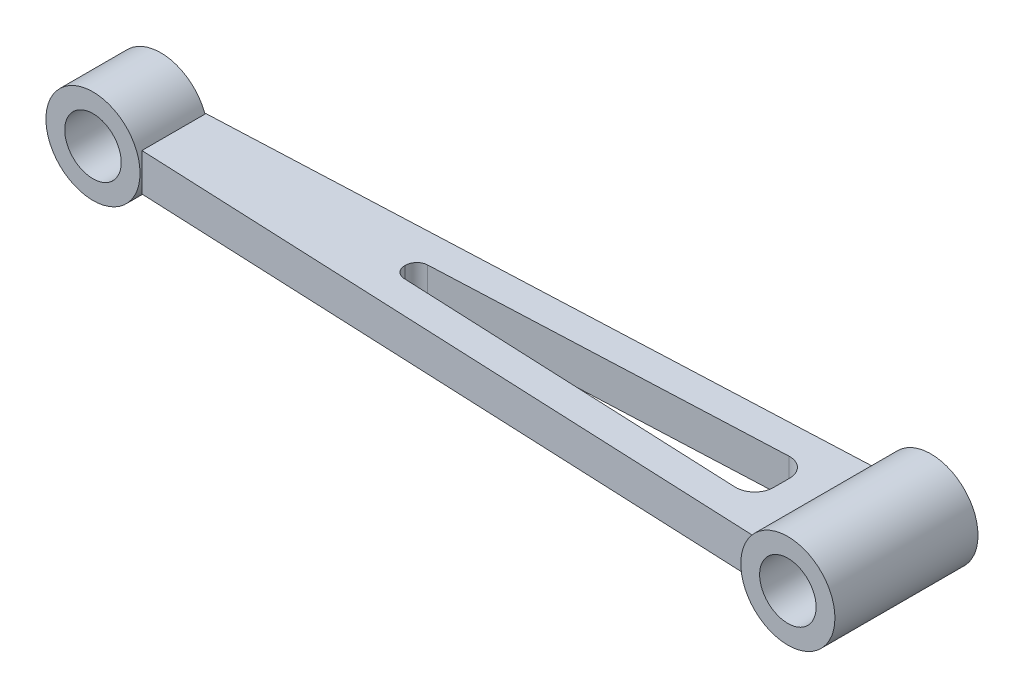
from build123d import *

# Parameters (mm, degrees)
BOSS_EXTRUDE1_DEPTH = 10
SKETCH3_R           = 12.5
SKETCH3_R_2         = 7.5
BOSS_EXTRUDE2_DEPTH = 9
SKETCH4_R           = 12.5
SKETCH4_R_2         = 7.5
BOSS_EXTRUDE3_DEPTH = 19


with BuildPart() as part:
    # Sketch2 → Boss-Extrude1 (new body)
    with BuildSketch(Plane(origin=(0, 0, 0), x_dir=(1, 0, 0), z_dir=(0, 1, 0))):
        Polygon((0, 8.5), (169.56, 15.90314948), (169.56, -15.90314948), (0, -8.5), align=None)
        with BuildLine():
            Line((61.39, 0), (61.39, 0.128124773))
            ThreePointArc((61.39, 0.128124773), (62.222908114, 2.202663941), (64.259141838, 3.125269438))
            Line((64.259141838, 3.125269438), (156.171903063, 7.138267258))
            ThreePointArc((156.171903063, 7.138267258), (159.847565279, 5.754845961), (161.39, 2.14302615))
            Line((161.39, 2.14302615), (161.39, -2.14302615))
            ThreePointArc((161.39, -2.14302615), (159.847565279, -5.754845961), (156.171903063, -7.138267258))
            Line((156.171903063, -7.138267258), (64.259141838, -3.125269438))
            ThreePointArc((64.259141838, -3.125269438), (62.222908114, -2.202663941), (61.39, -0.128124773))
            Line((61.39, -0.128124773), (61.39, 0))
        make_face(mode=Mode.SUBTRACT)
    extrude(amount=-BOSS_EXTRUDE1_DEPTH)


with BuildPart() as body_2:
    # Sketch3 → Boss-Extrude2 (new, symmetric)
    with BuildSketch(Plane.XY):
        with Locations((-12.5, -5)):
            Circle(SKETCH3_R)
        with Locations((-12.5, -5)):
            Circle(SKETCH3_R_2, mode=Mode.SUBTRACT)
    extrude(amount=BOSS_EXTRUDE2_DEPTH, both=True)


with BuildPart() as body_3:
    # Sketch4 → Boss-Extrude3 (new, symmetric)
    with BuildSketch(Plane.XY):
        with Locations((182.06, -5)):
            Circle(SKETCH4_R)
        with Locations((182.06, -5)):
            Circle(SKETCH4_R_2, mode=Mode.SUBTRACT)
    extrude(amount=BOSS_EXTRUDE3_DEPTH, both=True)


solid = Compound([part.part, body_2.part, body_3.part])
